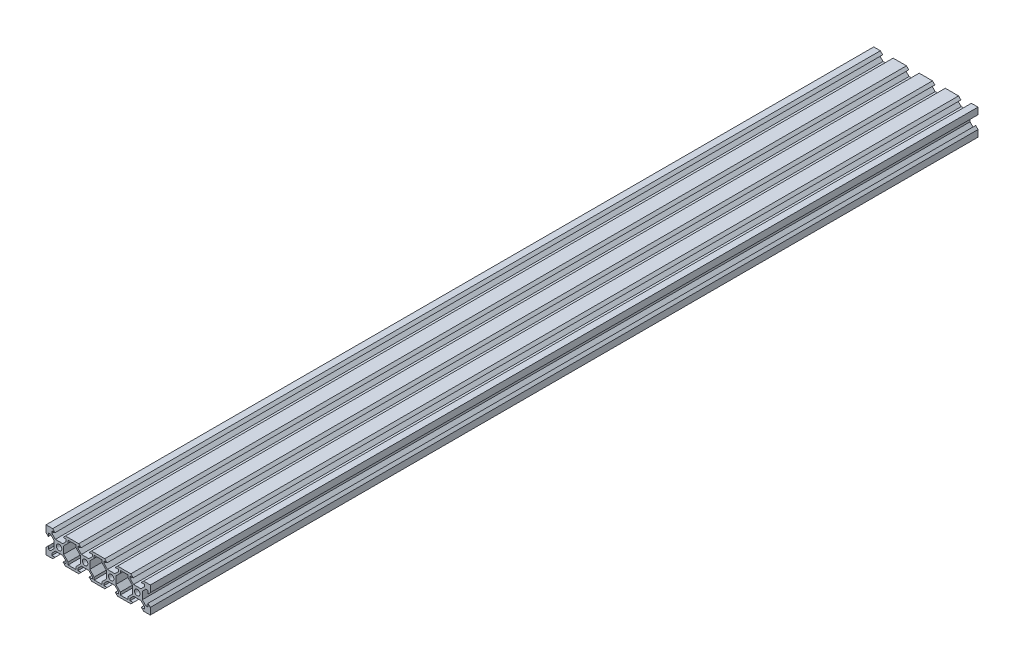
from build123d import *

# Parameters (mm, degrees)
ESQUISSE1_W             = 80
ESQUISSE1_H             = 20
BOSS_EXTRU_1_DEPTH      = 635
ENL_V_MAT_EXTRU_1_REACH = 640.49
ESQUISSE2_R             = 2.1
ENL_V_MAT_EXTRU_2_REACH = 640.49


with BuildPart() as part:
    # Esquisse1 → Boss.-Extru.1 (new body)
    with BuildSketch(Plane.XY):
        with Locations((-25.62771875, -1.733873274)):
            Rectangle(ESQUISSE1_W, ESQUISSE1_H)
    extrude(amount=BOSS_EXTRU_1_DEPTH)

    # Esquisse2 → Enlèv. mat.-Extru.1 (cut, up to next)
    with BuildSketch(Plane(origin=(0, 0, 0), x_dir=(-1, 0, 0), z_dir=(0, 0, -1)), mode=Mode.PRIVATE) as enl_v_mat_extru_1_sk1:
        with Locations((55.62771875, -1.733873274)):
            Circle(ESQUISSE2_R)
    enl_v_mat_extru_1_tool1 = extrude(enl_v_mat_extru_1_sk1.sketch, amount=-ENL_V_MAT_EXTRU_1_REACH, mode=Mode.PRIVATE) & part.part
    # Esquisse2 → Enlèv. mat.-Extru.1 (cut, up to next)
    with BuildSketch(Plane(origin=(0, 0, 0), x_dir=(-1, 0, 0), z_dir=(0, 0, -1)), mode=Mode.PRIVATE) as enl_v_mat_extru_1_sk2:
        with Locations((35.62771875, -1.733873274)):
            Circle(ESQUISSE2_R)
    enl_v_mat_extru_1_tool2 = extrude(enl_v_mat_extru_1_sk2.sketch, amount=-ENL_V_MAT_EXTRU_1_REACH, mode=Mode.PRIVATE) & part.part
    # Esquisse2 → Enlèv. mat.-Extru.1 (cut, up to next)
    with BuildSketch(Plane(origin=(0, 0, 0), x_dir=(-1, 0, 0), z_dir=(0, 0, -1)), mode=Mode.PRIVATE) as enl_v_mat_extru_1_sk3:
        with Locations((15.62771875, -1.733873274)):
            Circle(ESQUISSE2_R)
    enl_v_mat_extru_1_tool3 = extrude(enl_v_mat_extru_1_sk3.sketch, amount=-ENL_V_MAT_EXTRU_1_REACH, mode=Mode.PRIVATE) & part.part
    # Esquisse2 → Enlèv. mat.-Extru.1 (cut, up to next)
    with BuildSketch(Plane(origin=(0, 0, 0), x_dir=(-1, 0, 0), z_dir=(0, 0, -1)), mode=Mode.PRIVATE) as enl_v_mat_extru_1_sk4:
        with Locations((-4.37228125, -1.733873274)):
            Circle(ESQUISSE2_R)
    enl_v_mat_extru_1_tool4 = extrude(enl_v_mat_extru_1_sk4.sketch, amount=-ENL_V_MAT_EXTRU_1_REACH, mode=Mode.PRIVATE) & part.part
    # Esquisse2 → Enlèv. mat.-Extru.1 (cut, up to next)
    with BuildSketch(Plane(origin=(0, 0, 0), x_dir=(-1, 0, 0), z_dir=(0, 0, -1)), mode=Mode.PRIVATE) as enl_v_mat_extru_1_sk5:
        Polygon((50.72771875, 8.266126726), (60.52771875, 8.266126726), (58.72771875, 6.466126726), (61.12771875, 6.466126726), (61.12771875, 4.826126726), (58.46771875, 2.166126726), (52.78771875, 2.166126726), (50.12771875, 4.826126726), (50.12771875, 6.466126726), (52.52771875, 6.466126726), align=None)
    enl_v_mat_extru_1_tool5 = extrude(enl_v_mat_extru_1_sk5.sketch, amount=-ENL_V_MAT_EXTRU_1_REACH, mode=Mode.PRIVATE) & part.part
    # Esquisse2 → Enlèv. mat.-Extru.1 (cut, up to next)
    with BuildSketch(Plane(origin=(0, 0, 0), x_dir=(-1, 0, 0), z_dir=(0, 0, -1)), mode=Mode.PRIVATE) as enl_v_mat_extru_1_sk6:
        Polygon((65.62771875, 3.166126726), (65.62771875, -6.633873274), (63.82771875, -4.833873274), (63.82771875, -7.233873274), (62.18771875, -7.233873274), (59.52771875, -4.573873274), (59.52771875, 1.106126726), (62.18771875, 3.766126726), (63.82771875, 3.766126726), (63.82771875, 1.366126726), align=None)
    enl_v_mat_extru_1_tool6 = extrude(enl_v_mat_extru_1_sk6.sketch, amount=-ENL_V_MAT_EXTRU_1_REACH, mode=Mode.PRIVATE) & part.part
    # Esquisse2 → Enlèv. mat.-Extru.1 (cut, up to next)
    with BuildSketch(Plane(origin=(0, 0, 0), x_dir=(-1, 0, 0), z_dir=(0, 0, -1)), mode=Mode.PRIVATE) as enl_v_mat_extru_1_sk7:
        Polygon((60.52771875, -11.733873274), (50.72771875, -11.733873274), (52.52771875, -9.933873274), (50.12771875, -9.933873274), (50.12771875, -8.293873274), (52.78771875, -5.633873274), (58.46771875, -5.633873274), (61.12771875, -8.293873274), (61.12771875, -9.933873274), (58.72771875, -9.933873274), align=None)
    enl_v_mat_extru_1_tool7 = extrude(enl_v_mat_extru_1_sk7.sketch, amount=-ENL_V_MAT_EXTRU_1_REACH, mode=Mode.PRIVATE) & part.part
    # Esquisse2 → Enlèv. mat.-Extru.1 (cut, up to next)
    with BuildSketch(Plane(origin=(0, 0, 0), x_dir=(-1, 0, 0), z_dir=(0, 0, -1)), mode=Mode.PRIVATE) as enl_v_mat_extru_1_sk8:
        Polygon((30.72771875, 8.266126726), (40.52771875, 8.266126726), (38.72771875, 6.466126726), (41.12771875, 6.466126726), (41.12771875, 4.826126726), (38.46771875, 2.166126726), (32.78771875, 2.166126726), (30.12771875, 4.826126726), (30.12771875, 6.466126726), (32.52771875, 6.466126726), align=None)
    enl_v_mat_extru_1_tool8 = extrude(enl_v_mat_extru_1_sk8.sketch, amount=-ENL_V_MAT_EXTRU_1_REACH, mode=Mode.PRIVATE) & part.part
    # Esquisse2 → Enlèv. mat.-Extru.1 (cut, up to next)
    with BuildSketch(Plane(origin=(0, 0, 0), x_dir=(-1, 0, 0), z_dir=(0, 0, -1)), mode=Mode.PRIVATE) as enl_v_mat_extru_1_sk9:
        Polygon((40.52771875, -11.733873274), (30.72771875, -11.733873274), (32.52771875, -9.933873274), (30.12771875, -9.933873274), (30.12771875, -8.293873274), (32.78771875, -5.633873274), (38.46771875, -5.633873274), (41.12771875, -8.293873274), (41.12771875, -9.933873274), (38.72771875, -9.933873274), align=None)
    enl_v_mat_extru_1_tool9 = extrude(enl_v_mat_extru_1_sk9.sketch, amount=-ENL_V_MAT_EXTRU_1_REACH, mode=Mode.PRIVATE) & part.part
    # Esquisse2 → Enlèv. mat.-Extru.1 (cut, up to next)
    with BuildSketch(Plane(origin=(0, 0, 0), x_dir=(-1, 0, 0), z_dir=(0, 0, -1)), mode=Mode.PRIVATE) as enl_v_mat_extru_1_sk10:
        Polygon((10.72771875, 8.266126726), (20.52771875, 8.266126726), (18.72771875, 6.466126726), (21.12771875, 6.466126726), (21.12771875, 4.826126726), (18.46771875, 2.166126726), (12.78771875, 2.166126726), (10.12771875, 4.826126726), (10.12771875, 6.466126726), (12.52771875, 6.466126726), align=None)
    enl_v_mat_extru_1_tool10 = extrude(enl_v_mat_extru_1_sk10.sketch, amount=-ENL_V_MAT_EXTRU_1_REACH, mode=Mode.PRIVATE) & part.part
    # Esquisse2 → Enlèv. mat.-Extru.1 (cut, up to next)
    with BuildSketch(Plane(origin=(0, 0, 0), x_dir=(-1, 0, 0), z_dir=(0, 0, -1)), mode=Mode.PRIVATE) as enl_v_mat_extru_1_sk11:
        Polygon((20.52771875, -11.733873274), (10.72771875, -11.733873274), (12.52771875, -9.933873274), (10.12771875, -9.933873274), (10.12771875, -8.293873274), (12.78771875, -5.633873274), (18.46771875, -5.633873274), (21.12771875, -8.293873274), (21.12771875, -9.933873274), (18.72771875, -9.933873274), align=None)
    enl_v_mat_extru_1_tool11 = extrude(enl_v_mat_extru_1_sk11.sketch, amount=-ENL_V_MAT_EXTRU_1_REACH, mode=Mode.PRIVATE) & part.part
    # Esquisse2 → Enlèv. mat.-Extru.1 (cut, up to next)
    with BuildSketch(Plane(origin=(0, 0, 0), x_dir=(-1, 0, 0), z_dir=(0, 0, -1)), mode=Mode.PRIVATE) as enl_v_mat_extru_1_sk12:
        Polygon((-9.27228125, 8.266126726), (0.52771875, 8.266126726), (-1.27228125, 6.466126726), (1.12771875, 6.466126726), (1.12771875, 4.826126726), (-1.53228125, 2.166126726), (-7.21228125, 2.166126726), (-9.87228125, 4.826126726), (-9.87228125, 6.466126726), (-7.47228125, 6.466126726), align=None)
    enl_v_mat_extru_1_tool12 = extrude(enl_v_mat_extru_1_sk12.sketch, amount=-ENL_V_MAT_EXTRU_1_REACH, mode=Mode.PRIVATE) & part.part
    # Esquisse2 → Enlèv. mat.-Extru.1 (cut, up to next)
    with BuildSketch(Plane(origin=(0, 0, 0), x_dir=(-1, 0, 0), z_dir=(0, 0, -1)), mode=Mode.PRIVATE) as enl_v_mat_extru_1_sk13:
        Polygon((0.52771875, -11.733873274), (-9.27228125, -11.733873274), (-7.47228125, -9.933873274), (-9.87228125, -9.933873274), (-9.87228125, -8.293873274), (-7.21228125, -5.633873274), (-1.53228125, -5.633873274), (1.12771875, -8.293873274), (1.12771875, -9.933873274), (-1.27228125, -9.933873274), align=None)
    enl_v_mat_extru_1_tool13 = extrude(enl_v_mat_extru_1_sk13.sketch, amount=-ENL_V_MAT_EXTRU_1_REACH, mode=Mode.PRIVATE) & part.part
    # Esquisse2 → Enlèv. mat.-Extru.1 (cut, up to next)
    with BuildSketch(Plane(origin=(0, 0, 0), x_dir=(-1, 0, 0), z_dir=(0, 0, -1)), mode=Mode.PRIVATE) as enl_v_mat_extru_1_sk14:
        Polygon((-14.37228125, -6.633873274), (-14.37228125, 3.166126726), (-12.57228125, 1.366126726), (-12.57228125, 3.766126726), (-10.93228125, 3.766126726), (-8.27228125, 1.106126726), (-8.27228125, -4.573873274), (-10.93228125, -7.233873274), (-12.57228125, -7.233873274), (-12.57228125, -4.833873274), align=None)
    enl_v_mat_extru_1_tool14 = extrude(enl_v_mat_extru_1_sk14.sketch, amount=-ENL_V_MAT_EXTRU_1_REACH, mode=Mode.PRIVATE) & part.part
    add(enl_v_mat_extru_1_tool1.solids().sort_by_distance((-55.627719, -1.733873, 0))[0], mode=Mode.SUBTRACT)
    add(enl_v_mat_extru_1_tool2.solids().sort_by_distance((-35.627719, -1.733873, 0))[0], mode=Mode.SUBTRACT)
    add(enl_v_mat_extru_1_tool3.solids().sort_by_distance((-15.627719, -1.733873, 0))[0], mode=Mode.SUBTRACT)
    add(enl_v_mat_extru_1_tool4.solids().sort_by_distance((4.372281, -1.733873, 0))[0], mode=Mode.SUBTRACT)
    add(enl_v_mat_extru_1_tool5.solids().sort_by_distance((-55.627719, 5.301599, 0))[0], mode=Mode.SUBTRACT)
    add(enl_v_mat_extru_1_tool6.solids().sort_by_distance((-62.663191, -1.733873, 0))[0], mode=Mode.SUBTRACT)
    add(enl_v_mat_extru_1_tool7.solids().sort_by_distance((-55.627719, -8.769346, 0))[0], mode=Mode.SUBTRACT)
    add(enl_v_mat_extru_1_tool8.solids().sort_by_distance((-35.627719, 5.301599, 0))[0], mode=Mode.SUBTRACT)
    add(enl_v_mat_extru_1_tool9.solids().sort_by_distance((-35.627719, -8.769346, 0))[0], mode=Mode.SUBTRACT)
    add(enl_v_mat_extru_1_tool10.solids().sort_by_distance((-15.627719, 5.301599, 0))[0], mode=Mode.SUBTRACT)
    add(enl_v_mat_extru_1_tool11.solids().sort_by_distance((-15.627719, -8.769346, 0))[0], mode=Mode.SUBTRACT)
    add(enl_v_mat_extru_1_tool12.solids().sort_by_distance((4.372281, 5.301599, 0))[0], mode=Mode.SUBTRACT)
    add(enl_v_mat_extru_1_tool13.solids().sort_by_distance((4.372281, -8.769346, 0))[0], mode=Mode.SUBTRACT)
    add(enl_v_mat_extru_1_tool14.solids().sort_by_distance((11.407754, -1.733873, 0))[0], mode=Mode.SUBTRACT)

    # Esquisse3 → Enlèv. mat.-Extru.2 (cut, up to next)
    with BuildSketch(Plane(origin=(0, 0, 0), x_dir=(-1, 0, 0), z_dir=(0, 0, -1)), mode=Mode.PRIVATE) as enl_v_mat_extru_2_sk1:
        Polygon((2.618256699, 6.466126726), (8.637180802, 6.466126726), (8.637180802, 4.506126726), (12.037180802, 1.106126726), (12.037180802, -4.573873274), (8.637180802, -7.973873274), (8.637180802, -9.933873274), (2.618256699, -9.933873274), (2.618256699, -7.973873274), (-0.781743301, -4.573873274), (-0.781743301, 1.106126726), (2.618256699, 4.506126726), align=None)
    enl_v_mat_extru_2_tool1 = extrude(enl_v_mat_extru_2_sk1.sketch, amount=-ENL_V_MAT_EXTRU_2_REACH, mode=Mode.PRIVATE) & part.part
    # Esquisse3 → Enlèv. mat.-Extru.2 (cut, up to next)
    with BuildSketch(Plane(origin=(0, 0, 0), x_dir=(-1, 0, 0), z_dir=(0, 0, -1)), mode=Mode.PRIVATE) as enl_v_mat_extru_2_sk2:
        Polygon((22.618256699, 6.466126726), (28.637180802, 6.466126726), (28.637180802, 4.506126726), (32.037180802, 1.106126726), (32.037180802, -4.573873274), (28.637180802, -7.973873274), (28.637180802, -9.933873274), (22.618256699, -9.933873274), (22.618256699, -7.973873274), (19.218256699, -4.573873274), (19.218256699, 1.106126726), (22.618256699, 4.506126726), align=None)
    enl_v_mat_extru_2_tool2 = extrude(enl_v_mat_extru_2_sk2.sketch, amount=-ENL_V_MAT_EXTRU_2_REACH, mode=Mode.PRIVATE) & part.part
    # Esquisse3 → Enlèv. mat.-Extru.2 (cut, up to next)
    with BuildSketch(Plane(origin=(0, 0, 0), x_dir=(-1, 0, 0), z_dir=(0, 0, -1)), mode=Mode.PRIVATE) as enl_v_mat_extru_2_sk3:
        Polygon((42.618256699, 6.466126726), (48.637180802, 6.466126726), (48.637180802, 4.506126726), (52.037180802, 1.106126726), (52.037180802, -4.573873274), (48.637180802, -7.973873274), (48.637180802, -9.933873274), (42.618256699, -9.933873274), (42.618256699, -7.973873274), (39.218256699, -4.573873274), (39.218256699, 1.106126726), (42.618256699, 4.506126726), align=None)
    enl_v_mat_extru_2_tool3 = extrude(enl_v_mat_extru_2_sk3.sketch, amount=-ENL_V_MAT_EXTRU_2_REACH, mode=Mode.PRIVATE) & part.part
    add(enl_v_mat_extru_2_tool1.solids().sort_by_distance((-5.627719, -1.733873, 0))[0], mode=Mode.SUBTRACT)
    add(enl_v_mat_extru_2_tool2.solids().sort_by_distance((-25.627719, -1.733873, 0))[0], mode=Mode.SUBTRACT)
    add(enl_v_mat_extru_2_tool3.solids().sort_by_distance((-45.627719, -1.733873, 0))[0], mode=Mode.SUBTRACT)


solid = part.part
